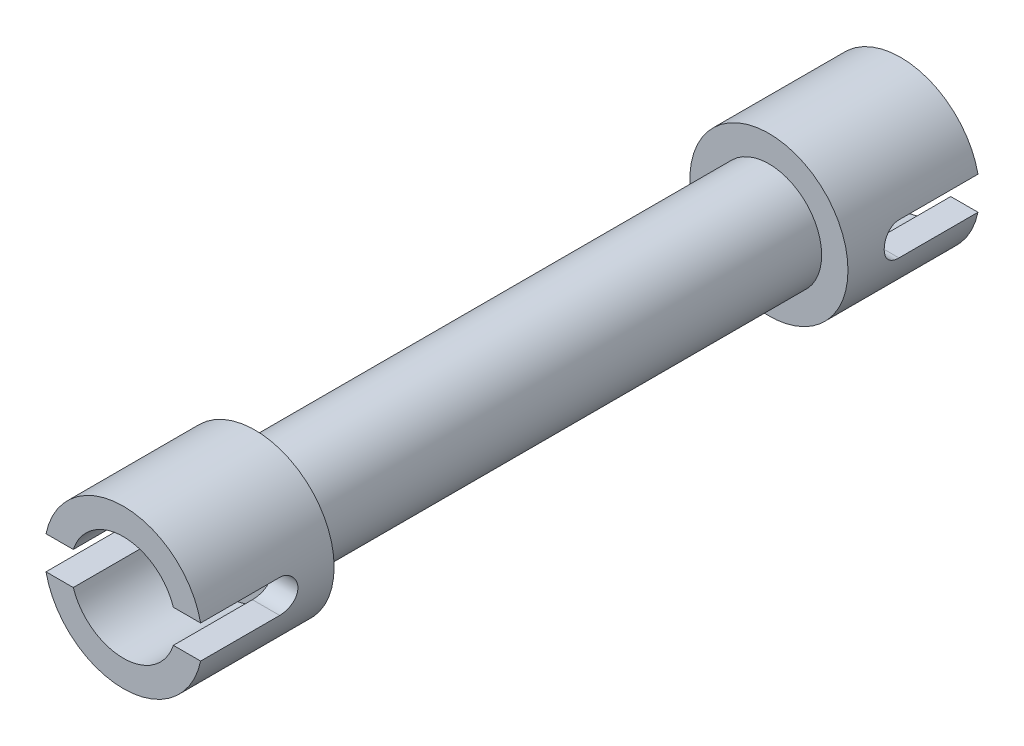
from build123d import *

# Parameters (mm, degrees)
CROQUIS1_R              = 4
SALIENTE_EXTRUIR1_DEPTH = 19.5
CROQUIS2_R              = 6
SALIENTE_EXTRUIR2_DEPTH = 10
CROQUIS3_R              = 4
CORTAR_EXTRUIR1_DEPTH   = 8
CORTAR_EXTRUIR2_DEPTH   = 33.407560846


with BuildPart() as part:
    # Croquis1 → Saliente-Extruir1 (new, symmetric)
    with BuildSketch(Plane.XY):
        Circle(CROQUIS1_R)
    extrude(amount=SALIENTE_EXTRUIR1_DEPTH, both=True)

    # Croquis2 → Saliente-Extruir2 (add)
    with BuildSketch(Plane.XY.offset(19.5)):
        Circle(CROQUIS2_R)
    saliente_extruir2 = extrude(amount=SALIENTE_EXTRUIR2_DEPTH)

    # Croquis3 → Cortar-Extruir1 (cut)
    with BuildSketch(Plane.XY.offset(29.5)):
        Circle(CROQUIS3_R)
    cortar_extruir1 = extrude(amount=-CORTAR_EXTRUIR1_DEPTH, mode=Mode.SUBTRACT)

    # Croquis4 → Cortar-Extruir2 (cut, through all)
    with BuildSketch(Plane(origin=(6, 0, 0), x_dir=(0, 0, -1), z_dir=(1, 0, 0))):
        with BuildLine():
            Line((-29.5, 1.25), (-23.5, 1.25))
            ThreePointArc((-23.5, 1.25), (-22.25, 0), (-23.5, -1.25))
            Line((-23.5, -1.25), (-29.5, -1.25))
            ThreePointArc((-29.5, -1.25), (-30.75, 0), (-29.5, 1.25))
        make_face()
    cortar_extruir2 = extrude(amount=-CORTAR_EXTRUIR2_DEPTH, mode=Mode.SUBTRACT)

    # Simetría2: Saliente-Extruir2, Cortar-Extruir1, Cortar-Extruir2 across plane
    add(saliente_extruir2.mirror(Plane.XY))
    add(cortar_extruir1.mirror(Plane.XY), mode=Mode.SUBTRACT)
    add(cortar_extruir2.mirror(Plane.XY), mode=Mode.SUBTRACT)


solid = part.part
